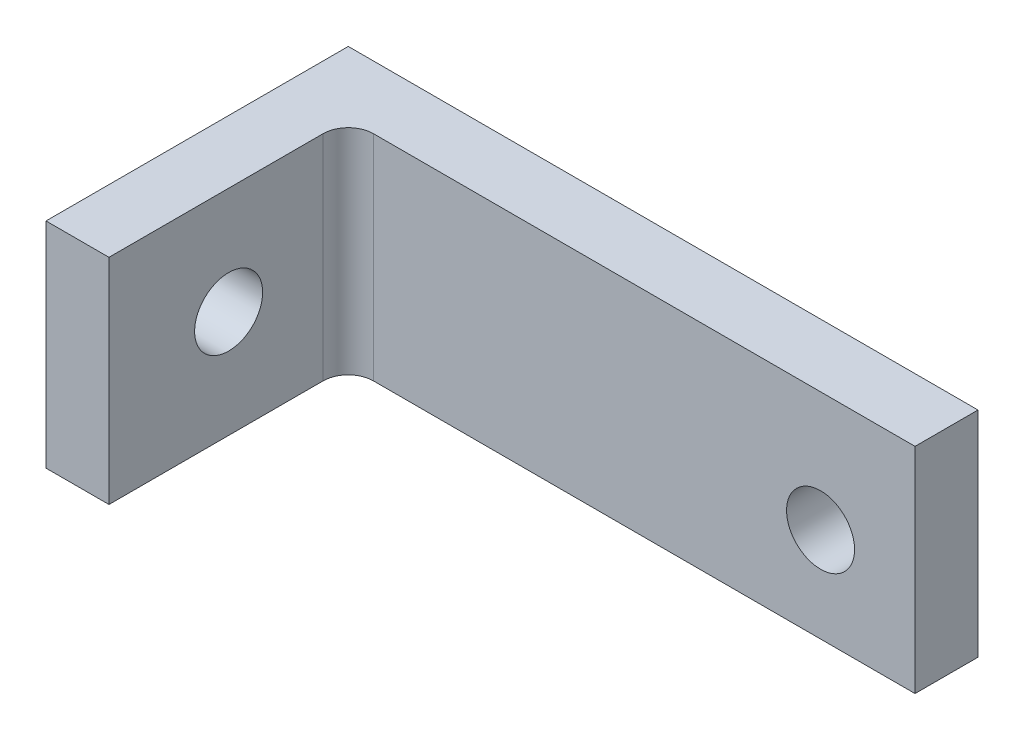
from build123d import *

# Parameters (mm, degrees)
BOSS_EXTRUDE1_DEPTH = 17
SKETCH2_R           = 2.7
CUT_EXTRUDE1_DEPTH  = 54.758720223
SKETCH3_R           = 2.7
CUT_EXTRUDE2_DEPTH  = 36.707142143
FILLET1_R           = 2


with BuildPart() as part:
    # Sketch1 → Boss-Extrude1 (new body)
    with BuildSketch(Plane(origin=(0, 0, 0), x_dir=(1, 0, 0), z_dir=(0, 1, 0))):
        Polygon((-25, 0), (25, 0), (25, -5), (-20, -5), (-20, -24), (-25, -24), align=None)
    extrude(amount=BOSS_EXTRUDE1_DEPTH)

    # Sketch2 → Cut-Extrude1 (cut, through all)
    with BuildSketch(Plane(origin=(-20, 0, 0), x_dir=(0, 0, -1), z_dir=(1, 0, 0))):
        with Locations((-14.5, 8.5)):
            Circle(SKETCH2_R)
    extrude(amount=-CUT_EXTRUDE1_DEPTH, mode=Mode.SUBTRACT)

    # Sketch3 → Cut-Extrude2 (cut, through all)
    with BuildSketch(Plane.XY.offset(5)):
        with Locations((17.5, 7.5)):
            Circle(SKETCH3_R)
    extrude(amount=-CUT_EXTRUDE2_DEPTH, mode=Mode.SUBTRACT)

    # Fillet1
    fillet1_edges = [part.edges().sort_by_distance(p)[0] for p in [
        (-20, 8.5, 5),
    ]]
    fillet(fillet1_edges, radius=FILLET1_R)


solid = part.part
